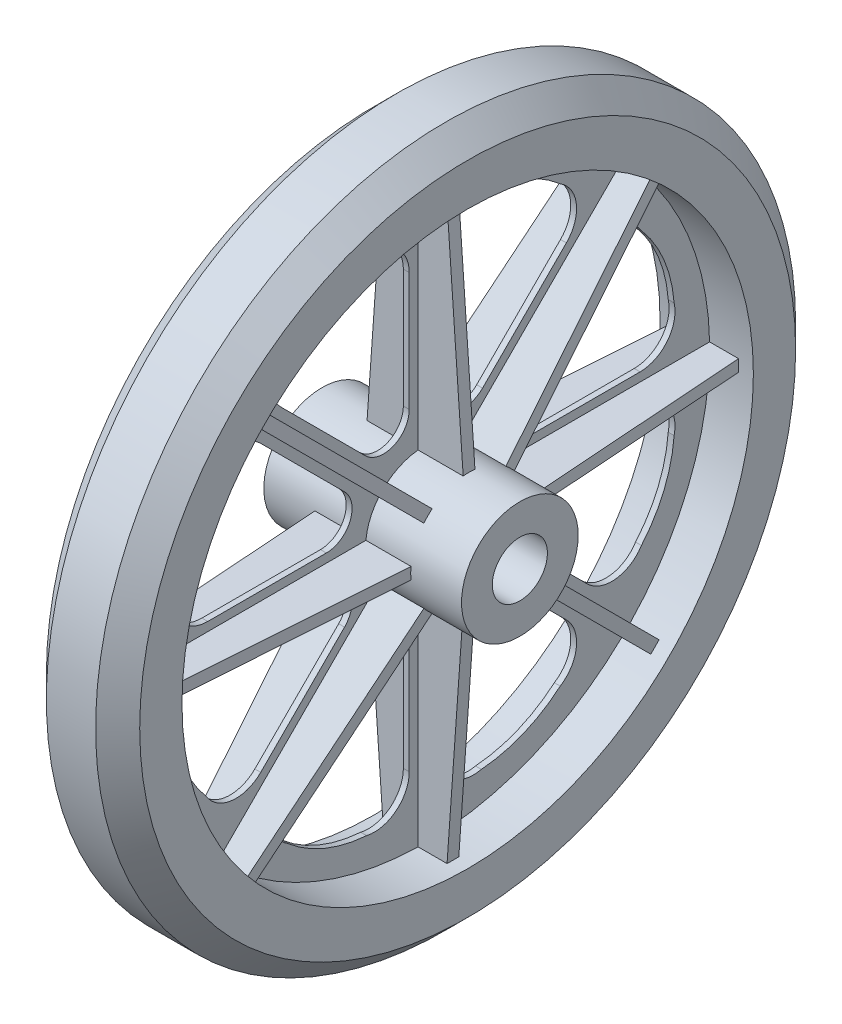
from build123d import *

# Parameters (mm, degrees)
RESSALTO_EXTRUS_O1_DEPTH      = 26.9
RESSALTO_EXTRUS_O1_DEPTH_BACK = 26.9
ESBO_O1_R                     = 15.875
RESSALTO_EXTRUS_O2_DEPTH      = 0.8
RESSALTO_EXTRUS_O2_DEPTH_BACK = 0.8
ESBO_O2_R                     = 95.25
RESSALTO_EXTRUS_O3_DEPTH      = 12.7
RESSALTO_EXTRUS_O3_DEPTH_BACK = 12.7
ESBO_O3_R                     = 95.25
ESBO_O3_R_2                   = 77.75
CORTE_EXTRUS_O1_DEPTH         = 138.522416355
PADR_OCIRCULAR2_COUNT         = 8
ESBO_O9_R                     = 7.5
CORTE_EXTRUS_O2_DEPTH         = 146.05021548
CHANFRO1_SIZE                 = 6


with BuildPart() as part:
    # Esboço1 → Ressalto-extrusão1 (new, two sides: drawn at the far end of the back side and taken through both)
    with BuildSketch(Plane(origin=(0, 0, 0), x_dir=(0, 0, -1), z_dir=(1, 0, 0)).offset(-RESSALTO_EXTRUS_O1_DEPTH_BACK)):
        Circle(ESBO_O1_R)
    extrude(amount=RESSALTO_EXTRUS_O1_DEPTH + RESSALTO_EXTRUS_O1_DEPTH_BACK)

    # Esboço2 → Ressalto-extrusão2 (add, two sides: drawn at the far end of the back side and taken through both)
    with BuildSketch(Plane(origin=(0, 0, 0), x_dir=(0, 0, -1), z_dir=(1, 0, 0)).offset(-RESSALTO_EXTRUS_O2_DEPTH_BACK)):
        Circle(ESBO_O2_R)
    extrude(amount=RESSALTO_EXTRUS_O2_DEPTH + RESSALTO_EXTRUS_O2_DEPTH_BACK)

    # Esboço3 → Ressalto-extrusão3 (add, two sides: drawn at the far end of the back side and taken through both)
    with BuildSketch(Plane(origin=(0, 0, 0), x_dir=(0, 0, -1), z_dir=(1, 0, 0)).offset(-RESSALTO_EXTRUS_O3_DEPTH_BACK)):
        Circle(ESBO_O3_R)
        Circle(ESBO_O3_R_2, mode=Mode.SUBTRACT)
    extrude(amount=RESSALTO_EXTRUS_O3_DEPTH + RESSALTO_EXTRUS_O3_DEPTH_BACK)

    # Esboço6 → Corte-extrusão1 (cut, through all)
    with BuildSketch(Plane(origin=(0.8, 0, 0), x_dir=(0, 0, -1), z_dir=(1, 0, 0))):
        with BuildLine():
            Line((4, 58.820680887), (4, 26.556349186))
            ThreePointArc((4, 26.556349186), (8.321215973, 20.089192459), (15.949747468, 21.606601718))
            Line((15.949747468, 21.606601718), (38.764075204, 44.420929454))
            ThreePointArc((38.764075204, 44.420929454), (41.486184453, 52.207791794), (37.091172671, 59.188406043))
            ThreePointArc((37.091172671, 59.188406043), (27.072506592, 65.358812582), (15.625103563, 68.079942998))
            ThreePointArc((15.625103563, 68.079942998), (7.581321256, 66.25164596), (4, 58.820680887))
        make_face()
    corte_extrus_o1 = extrude(amount=-CORTE_EXTRUS_O1_DEPTH, mode=Mode.SUBTRACT)

    # Esboço7 → Loft2 section 0
    with BuildSketch(Plane(origin=(0, 0, 0), x_dir=(1, 0, 0), z_dir=(0, 1, 0))):
        with BuildLine():
            Line((-14.2, -1.6), (14.2, -1.6))
            Line((14.2, -1.6), (14.2, 1.6))
            Line((14.2, 1.6), (-14.2, 1.6))
            Line((-14.2, 1.6), (-14.2, -1.6))
        make_face()
    # Esboço8 → Loft2 section 1
    with BuildSketch(Plane(origin=(0, 88.828401724, 0), x_dir=(1, 0, 0), z_dir=(0, 1, 0))):
        with BuildLine():
            Line((-7.9, -1.6), (7.9, -1.6))
            Line((7.9, -1.6), (7.9, 1.6))
            Line((7.9, 1.6), (-7.9, 1.6))
            Line((-7.9, 1.6), (-7.9, -1.6))
        make_face()
    loft2 = loft()

    # PadrãoCircular2: Corte-extrusão1, Loft2 ×8 about axis
    padr_ocircular2_axis = Axis((-12.7, 0, 0), (1, 0, 0))
    add([corte_extrus_o1.rotate(padr_ocircular2_axis, i * 360 / PADR_OCIRCULAR2_COUNT) for i in range(1, PADR_OCIRCULAR2_COUNT)], mode=Mode.SUBTRACT)
    add([loft2.rotate(padr_ocircular2_axis, i * 360 / PADR_OCIRCULAR2_COUNT) for i in range(1, PADR_OCIRCULAR2_COUNT)])

    # Esboço9 → Corte-extrusão2 (cut, through all)
    with BuildSketch(Plane.ZY.offset(26.9)):
        Circle(ESBO_O9_R)
    extrude(amount=-CORTE_EXTRUS_O2_DEPTH, mode=Mode.SUBTRACT)

    # Chanfro1
    chanfro1_edges = [part.edges().sort_by_distance(p)[0] for p in [
        (12.7, 0, 95.25),
        (-12.7, 0, 95.25),
    ]]
    chamfer(chanfro1_edges, length=CHANFRO1_SIZE)


solid = part.part
